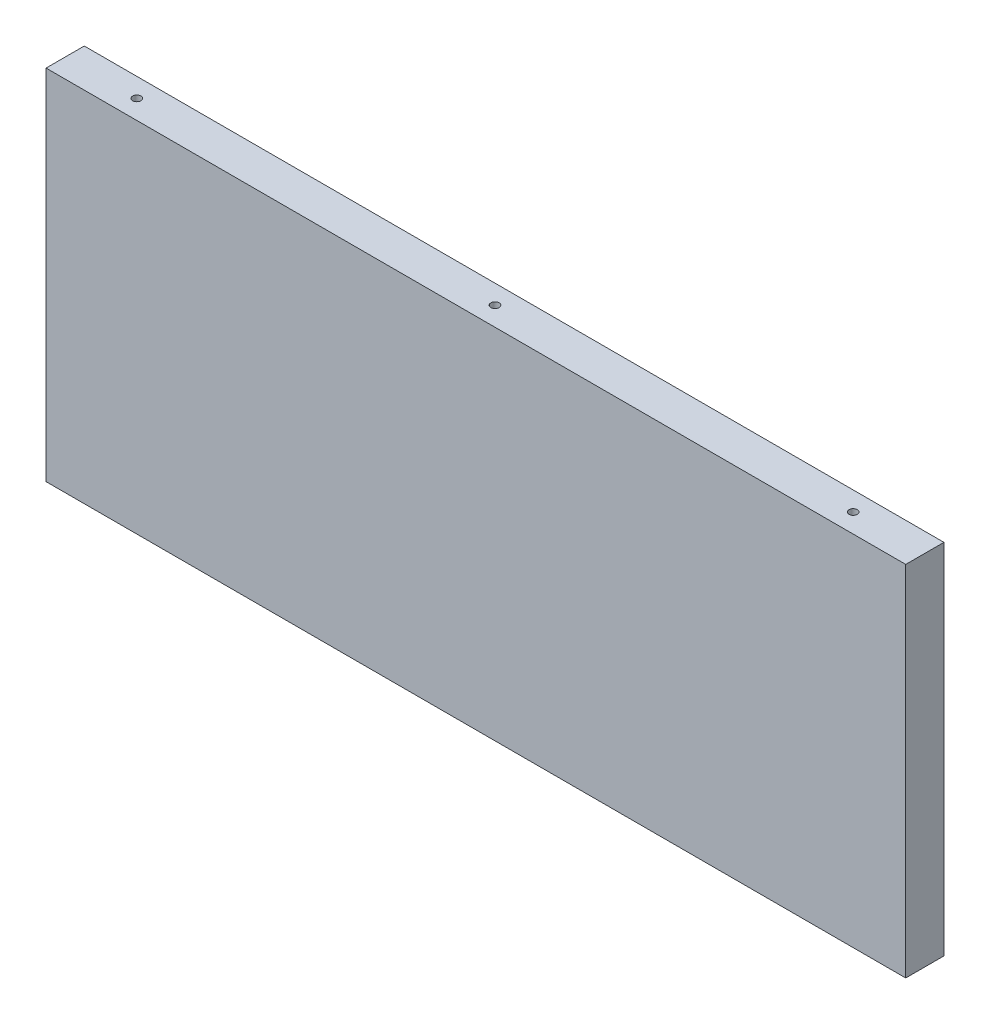
from build123d import *

# Parameters (mm, degrees)
SKETCH1_W                      = 360
SKETCH1_H                      = 150
BOSS_EXTRUDE1_DEPTH            = 8
F_8_36_TAPPED_HOLE1_AT_2_COUNT = 2
F_8_36_TAPPED_HOLE1_AT_2_PITCH = 31
F_8_36_TAPPED_HOLE2_D          = 3.4544
F_8_36_TAPPED_HOLE2_DEPTH      = 25
F_8_36_TAPPED_HOLE2_TIP        = 1.037806461


with BuildPart() as part:
    # Sketch1 → Boss-Extrude1 (new, symmetric)
    with BuildSketch(Plane.XY):
        Rectangle(SKETCH1_W, SKETCH1_H)
    extrude(amount=BOSS_EXTRUDE1_DEPTH, both=True)

    # Sketch3 → #8-36 Tapped Hole1 (revolve, cut)
    with BuildSketch(Plane(origin=(-142.5, -75, 0), x_dir=(0, 0, -1), z_dir=(1, 0, 0))):
        Polygon((0, 0), (0, 26.037806461), (1.7272, 25), (1.7272, 0), align=None)
    f_8_36_tapped_hole1 = revolve(axis=Axis((-142.5, -81.35, 0), (0, 1, 0)), mode=Mode.SUBTRACT)

    # #8-36 Tapped Hole1 at 2: #8-36 Tapped Hole1 ×2
    with Locations(*[(i * F_8_36_TAPPED_HOLE1_AT_2_PITCH, 0, 0) for i in range(1, F_8_36_TAPPED_HOLE1_AT_2_COUNT)]):
        add(f_8_36_tapped_hole1, mode=Mode.SUBTRACT)

    # Sketch6 → M8 Clearance Hole1 (revolve, cut)
    with BuildSketch(Plane(origin=(-127, -75, 0), x_dir=(0, 0, -1), z_dir=(1, 0, 0))):
        Polygon((0, 0), (0, 48.004303095), (5, 45), (5, 0), align=None)
    m8_clearance_hole1 = revolve(axis=Axis((-127, -81.35, 0), (0, 1, 0)), mode=Mode.SUBTRACT)

    # Mirror1: #8-36 Tapped Hole1, M8 Clearance Hole1 across plane
    add(f_8_36_tapped_hole1.mirror(Plane(origin=(0, 0, 0), x_dir=(0, 0, 1), z_dir=(1, 0, 0))), mode=Mode.SUBTRACT)
    add(m8_clearance_hole1.mirror(Plane(origin=(0, 0, 0), x_dir=(0, 0, 1), z_dir=(1, 0, 0))), mode=Mode.SUBTRACT)

    # Mirror1 copy 1 sketch → Mirror1 copy 1 (revolve, cut)
    with BuildSketch(Plane(origin=(111.5, -75, 0), x_dir=(0, 0, -1), z_dir=(-1, 0, 0))):
        Polygon((0, 0), (0, -26.037806461), (1.7272, -25), (1.7272, 0), align=None)
    revolve(axis=Axis((111.5, -81.35, 0), (0, -1, 0)), mode=Mode.SUBTRACT)

    # #8-36 Tapped Hole2
    with Locations(Plane(origin=(597.704940286, 75, -222), x_dir=(1, 0, 0), z_dir=(0, 1, 0))):
        with Locations((-447.704940286, -222), (-597.704940286, -222), (-747.704940286, -222)):
            Hole(F_8_36_TAPPED_HOLE2_D / 2, depth=F_8_36_TAPPED_HOLE2_DEPTH)
            with Locations((0, 0, -(F_8_36_TAPPED_HOLE2_DEPTH + F_8_36_TAPPED_HOLE2_TIP / 2))):  # 118° drill point
                Cone(0, F_8_36_TAPPED_HOLE2_D / 2, F_8_36_TAPPED_HOLE2_TIP, mode=Mode.SUBTRACT)


solid = part.part
